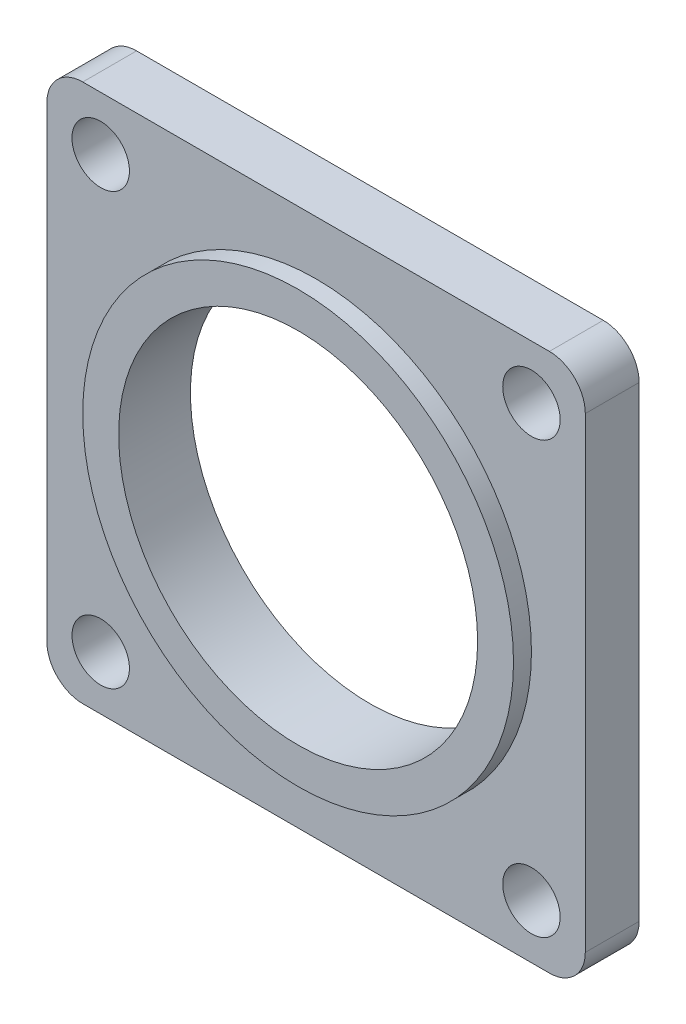
from build123d import *

# Parameters (mm, degrees)
SKETCH_1_W          = 30
SKETCH_1_H          = 30
EXTRUDE_1_DEPTH     = 3
SKETCH_2_R          = 12
EXTRUDE_2_DEPTH     = 1
SKETCH_3_R          = 10
CUT_EXTRUDE_2_DEPTH = 22.587033145
SKETCH_4_R          = 1.6
CUT_EXTRUDE_3_DEPTH = 22.587033145
FILLET_1_R          = 2


with BuildPart() as part:
    # 草图1 → 凸台-拉伸1 (new body)
    with BuildSketch(Plane.XY):
        Rectangle(SKETCH_1_W, SKETCH_1_H)
    extrude(amount=EXTRUDE_1_DEPTH)

    # 草图2 → 凸台-拉伸2 (add)
    with BuildSketch(Plane.XY.offset(3)):
        Circle(SKETCH_2_R)
    extrude(amount=EXTRUDE_2_DEPTH)

    # 草图3 → 切除-拉伸2 (cut, through all)
    with BuildSketch(Plane.XY.offset(4)):
        Circle(SKETCH_3_R)
    extrude(amount=-CUT_EXTRUDE_2_DEPTH, mode=Mode.SUBTRACT)

    # 草图4 → 切除-拉伸3 (cut, through all)
    with BuildSketch(Plane(origin=(0, 0, 0), x_dir=(-1, 0, 0), z_dir=(0, 0, -1))):
        with Locations((12, 12)):
            Circle(SKETCH_4_R)
        with Locations((-12, 12)):
            Circle(SKETCH_4_R)
        with Locations(Location((12, -12, 0), (0, 0, 180))):
            Circle(SKETCH_4_R)
        with Locations(Location((-12, -12, 0), (0, 0, 180))):
            Circle(SKETCH_4_R)
    extrude(amount=-CUT_EXTRUDE_3_DEPTH, mode=Mode.SUBTRACT)

    # 圆角1
    fillet_1_edges = [part.edges().sort_by_distance(p)[0] for p in [
        (-15, 15, 1.5),
        (15, 15, 1.5),
        (15, -15, 1.5),
        (-15, -15, 1.5),
    ]]
    fillet(fillet_1_edges, radius=FILLET_1_R)


solid = part.part
